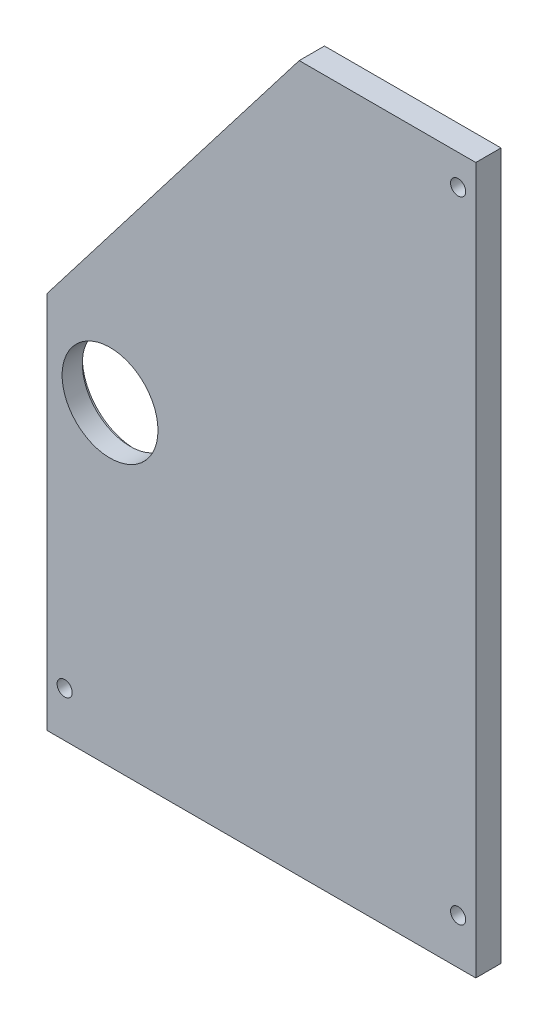
from build123d import *

# Parameters (mm, degrees)
SKETCH1_R           = 1.5
SKETCH1_R_2         = 10.5
BOSS_EXTRUDE1_DEPTH = 5
BOSS_EXTRUDE2_START = 1
SKETCH1_3_R         = 10.5
SKETCH1_3_R_2       = 9.5
BOSS_EXTRUDE2_DEPTH = 4


with BuildPart() as part:
    # Sketch1 → Boss-Extrude1 (new body)
    with BuildSketch(Plane.XY):
        Polygon((-25, 0), (50, 0), (60, 0), (60, 140), (25, 140), (-25, 75), align=None)
        with Locations((-21.5, 9)):
            Circle(SKETCH1_R, mode=Mode.SUBTRACT)
        with Locations((-12.5, 62.5)):
            Circle(SKETCH1_R_2, mode=Mode.SUBTRACT)
        with Locations((56.5, 9)):
            Circle(SKETCH1_R, mode=Mode.SUBTRACT)
        with Locations((56.5, 134)):
            Circle(SKETCH1_R, mode=Mode.SUBTRACT)
    extrude(amount=BOSS_EXTRUDE1_DEPTH)

    # Sketch1<3> → Boss-Extrude2 (add)
    with BuildSketch(Plane.XY.offset(BOSS_EXTRUDE2_START)):
        with Locations((-12.5, 62.5)):
            Circle(SKETCH1_3_R)
        with Locations((-12.5, 62.5)):
            Circle(SKETCH1_3_R_2, mode=Mode.SUBTRACT)
    extrude(amount=BOSS_EXTRUDE2_DEPTH)


solid = part.part
